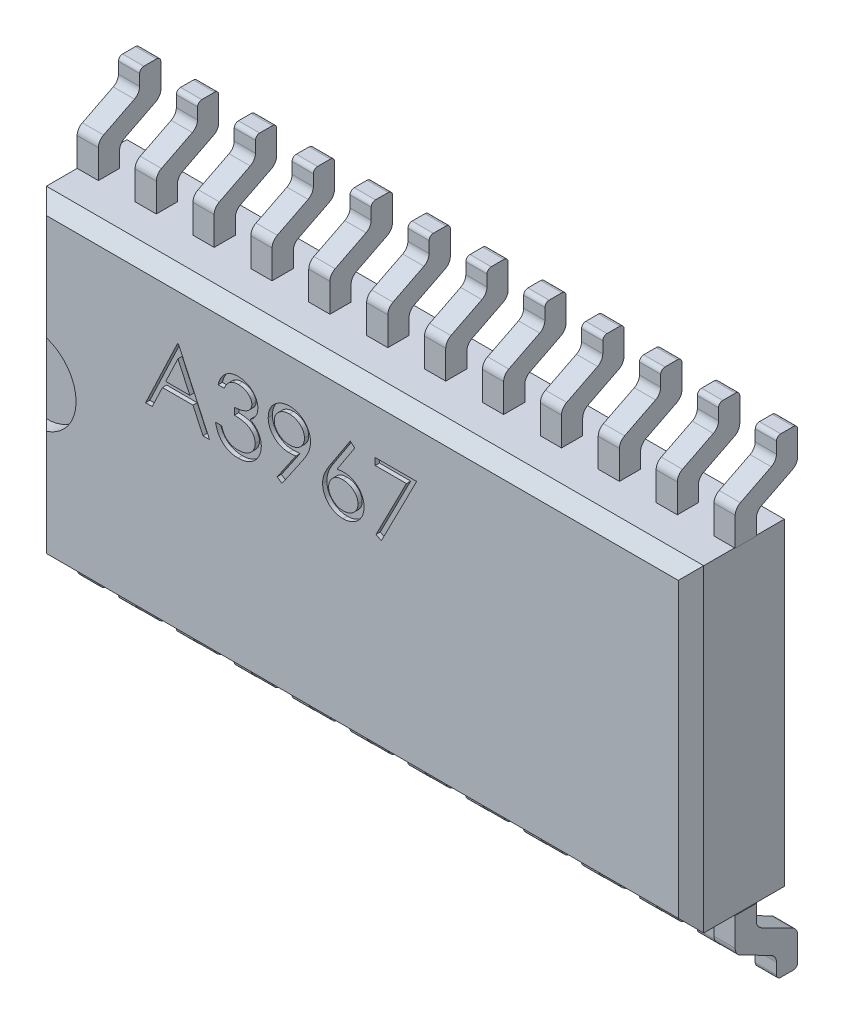
from build123d import *

# Parameters (mm, degrees)
SKETCH1_W           = 15.5
SKETCH1_H           = 7.5
BOSS_EXTRUDE1_DEPTH = 2.5
CHAMFER1_SIZE       = 0.3
BOSS_EXTRUDE2_DEPTH = 0.5
LPATTERN1_COUNT     = 12
LPATTERN1_PITCH     = 1.365
SKETCH3_R           = 1
CUT_EXTRUDE1_DEPTH  = 0.3
CUT_EXTRUDE2_DEPTH  = 0.1
SKETCH5_W           = 0.5
SKETCH5_H           = 0.01
CUT_EXTRUDE3_DEPTH  = 0.01


with BuildPart() as part:
    # Sketch1 → Boss-Extrude1 (new body)
    with BuildSketch(Plane.XY):
        Rectangle(SKETCH1_W, SKETCH1_H)
    extrude(amount=BOSS_EXTRUDE1_DEPTH)

    # Chamfer1
    chamfer1_edges = [part.edges().sort_by_distance(p)[0] for p in [
        (-7.75, 0, 2.5),
        (0, -3.75, 2.5),
        (7.75, 0, 2.5),
        (0, -3.75, 0),
        (-7.75, 0, 0),
        (0, 3.75, 0),
        (7.75, 0, 0),
        (0, 3.75, 2.5),
    ]]
    chamfer(chamfer1_edges, length=CHAMFER1_SIZE)

    # Sketch2 → Boss-Extrude2 (add)
    with BuildSketch(Plane.ZY.offset(7.75)):
        with BuildLine():
            Line((0.97300282, 3.75), (0.97300282, 4.113207126))
            ThreePointArc((0.97300282, 4.113207126), (0.940055615, 4.229754001), (0.85096669, 4.311801887))
            Line((0.85096669, 4.311801887), (0.12203613, 4.680948996))
            ThreePointArc((0.12203613, 4.680948996), (0.032947204, 4.762996882), (0, 4.879543757))
            Line((0, 4.879543757), (0, 5.45))
            ThreePointArc((0, 5.45), (0.029289322, 5.520710678), (0.1, 5.55))
            Line((0.1, 5.55), (0.4, 5.55))
            ThreePointArc((0.4, 5.55), (0.470710678, 5.520710678), (0.5, 5.45))
            Line((0.5, 5.45), (0.5, 5.186792874))
            ThreePointArc((0.5, 5.186792874), (0.532947204, 5.070245999), (0.62203613, 4.988198113))
            Line((0.62203613, 4.988198113), (1.35096669, 4.619051004))
            ThreePointArc((1.35096669, 4.619051004), (1.440055615, 4.537003118), (1.47300282, 4.420456243))
            Line((1.47300282, 4.420456243), (1.47300282, 3.75))
            Line((1.47300282, 3.75), (0.97300282, 3.75))
        make_face()
        with BuildLine():
            Line((0.1, -5.55), (0.4, -5.55))
            ThreePointArc((0.4, -5.55), (0.470710678, -5.520710678), (0.5, -5.45))
            Line((0.5, -5.45), (0.5, -5.186792874))
            ThreePointArc((0.5, -5.186792874), (0.532947204, -5.070245999), (0.62203613, -4.988198113))
            Line((0.62203613, -4.988198113), (1.35096669, -4.619051004))
            ThreePointArc((1.35096669, -4.619051004), (1.440055615, -4.537003118), (1.47300282, -4.420456243))
            Line((1.47300282, -4.420456243), (1.47300282, -3.75))
            Line((1.47300282, -3.75), (0.97300282, -3.75))
            Line((0.97300282, -3.75), (0.97300282, -4.113207126))
            ThreePointArc((0.97300282, -4.113207126), (0.940055615, -4.229754001), (0.85096669, -4.311801887))
            Line((0.85096669, -4.311801887), (0.12203613, -4.680948996))
            ThreePointArc((0.12203613, -4.680948996), (0.032947204, -4.762996882), (0, -4.879543757))
            Line((0, -4.879543757), (0, -5.45))
            ThreePointArc((0, -5.45), (0.029289322, -5.520710678), (0.1, -5.55))
        make_face()
    boss_extrude2 = extrude(amount=-BOSS_EXTRUDE2_DEPTH)

    # LPattern1: Boss-Extrude2 ×12
    with Locations(*[(i * LPATTERN1_PITCH, 0, 0) for i in range(1, LPATTERN1_COUNT)]):
        add(boss_extrude2)

    # Sketch3 → Cut-Extrude1 (cut)
    with BuildSketch(Plane.XY.offset(2.5)):
        with Locations((-7.75, 0)):
            Circle(SKETCH3_R)
    extrude(amount=-CUT_EXTRUDE1_DEPTH, mode=Mode.SUBTRACT)

    # Sketch4 → Cut-Extrude2 (cut)
    # profile 1 of 5: a face of its own
    with BuildSketch(Plane.XY.offset(2.5)):
        Polygon((-4.335376001, 2.385862006), (-3.602683694, 0.798362006), (-3.757553986, 0.798362006), (-3.992244491, 1.307176109), (-4.711898437, 1.307176109), (-4.953267127, 0.798362006), (-5.108773437, 0.798362006), (-4.355728565, 2.385862006), align=None)
        Polygon((-4.347142327, 2.07643943), (-4.634622295, 1.469996621), (-4.067294571, 1.469996621), align=None, mode=Mode.SUBTRACT)
    # profile 2 of 5: a face of its own
    with BuildSketch(Plane.XY.offset(2.5)):
        with BuildLine():
            Line((-3.256690104, 2.019515852), (-3.399158053, 2.019515852))
            add(Edge.make_bspline(
                [(-3.399158053, 2.019515852), (-3.395298363, 2.0354963), (-3.387752987, 2.066736769), (-3.372015159, 2.111371491), (-3.354870497, 2.15360966), (-3.334283296, 2.192660379), (-3.31182754, 2.229308453), (-3.286099734, 2.262722663), (-3.25828686, 2.293752829), (-3.2275234, 2.321290619), (-3.195261472, 2.346226946), (-3.161046483, 2.367488133), (-3.125566814, 2.385778016), (-3.088576643, 2.400845765), (-3.049965844, 2.412196627), (-3.010083479, 2.420432035), (-2.968825034, 2.425780148), (-2.940818091, 2.426302101), (-2.926596955, 2.426567134)],
                knots=[0, 0, 0, 0, 1.162005537, 2.271625781, 3.343758855, 4.383309926, 5.390229558, 6.379919256, 7.361854164, 8.333198761, 9.295911338, 10.242430842, 11.177959212, 12.116337295, 13.062827104, 14.020064771, 14.994644689, 16, 16, 16, 16], degree=3))
            add(Edge.make_bspline(
                [(-2.926596955, 2.426567134), (-2.905876568, 2.425941555), (-2.864887767, 2.424704042), (-2.804670242, 2.413403565), (-2.746600935, 2.395521451), (-2.691315454, 2.370813725), (-2.639962808, 2.34033948), (-2.594271752, 2.30406976), (-2.554861606, 2.262704362), (-2.521798799, 2.217014949), (-2.49591121, 2.168185486), (-2.476822034, 2.1179297), (-2.465200771, 2.066366806), (-2.463694662, 2.031551897), (-2.462940104, 2.014109702)],
                knots=[0, 0, 0, 0, 1.083050992, 2.142477498, 3.193116406, 4.255571735, 5.30263384, 6.308962982, 7.297363603, 8.282367274, 9.249857812, 10.179914175, 11.08814088, 12, 12, 12, 12], degree=3))
            add(Edge.make_bspline(
                [(-2.462940104, 2.014109702), (-2.463467875, 1.997324478), (-2.464500643, 1.964478398), (-2.473269859, 1.916526147), (-2.488027378, 1.871331564), (-2.508469735, 1.828704394), (-2.534931795, 1.788914913), (-2.566986911, 1.751873598), (-2.604861333, 1.717416159), (-2.633562851, 1.697676969), (-2.648339242, 1.68751465)],
                knots=[0, 0, 0, 0, 1.024540389, 2.004866551, 2.965041327, 3.920577974, 4.882998113, 5.874504559, 6.905732034, 8, 8, 8, 8], degree=3))
            add(Edge.make_bspline(
                [(-2.648339242, 1.68751465), (-2.631451982, 1.679360265), (-2.597993436, 1.66320407), (-2.552386588, 1.631519495), (-2.510985552, 1.59493608), (-2.48789708, 1.566387091), (-2.476296474, 1.552042895)],
                knots=[0, 0, 0, 0, 1.015518401, 2.012035669, 3.001164323, 4, 4, 4, 4], degree=3))
            add(Edge.make_bspline(
                [(-2.476296474, 1.552042895), (-2.468657722, 1.541584558), (-2.453505309, 1.520839146), (-2.434802049, 1.487485124), (-2.417834343, 1.453761413), (-2.404612637, 1.418764111), (-2.394373776, 1.382898851), (-2.387054933, 1.34610405), (-2.382508269, 1.308349661), (-2.381857143, 1.282807929), (-2.381529847, 1.269969077)],
                knots=[0, 0, 0, 0, 1.025084078, 2.033381695, 3.024893161, 4.013698104, 4.991890475, 5.976764909, 6.982997093, 8, 8, 8, 8], degree=3))
            add(Edge.make_bspline(
                [(-2.381529847, 1.269969077), (-2.382343787, 1.247739668), (-2.383967837, 1.203385462), (-2.398483971, 1.137855856), (-2.420987119, 1.073800003), (-2.452944372, 1.012533915), (-2.491891421, 0.955211385), (-2.538227065, 0.903923202), (-2.591424828, 0.859836692), (-2.650754533, 0.823002053), (-2.715033374, 0.793557138), (-2.783783732, 0.77312037), (-2.856015006, 0.759809863), (-2.905548316, 0.758382533), (-2.930731069, 0.757656878)],
                knots=[0, 0, 0, 0, 0.955779014, 1.907060117, 2.875433937, 3.871313158, 4.872415639, 5.851225146, 6.836215519, 7.83643374, 8.849228613, 9.86973379, 10.916971861, 12, 12, 12, 12], degree=3))
            add(Edge.make_bspline(
                [(-2.930731069, 0.757656878), (-2.947703395, 0.758050675), (-2.981099272, 0.758825535), (-3.03019543, 0.764122615), (-3.077059201, 0.773797296), (-3.121753947, 0.786816295), (-3.164319374, 0.80332255), (-3.204625593, 0.823877816), (-3.242920581, 0.84805839), (-3.278842962, 0.876149696), (-3.312388455, 0.907573733), (-3.342665584, 0.942888355), (-3.370179133, 0.981440749), (-3.394192401, 1.023678706), (-3.415799162, 1.069056377), (-3.433570524, 1.118154803), (-3.449212193, 1.170535056), (-3.456484514, 1.207037459), (-3.460215745, 1.225765852)],
                knots=[0, 0, 0, 0, 1.048658725, 2.063410685, 3.046034179, 4.001477787, 4.936774919, 5.862367409, 6.792675028, 7.730719943, 8.675894397, 9.627829632, 10.600096036, 11.597688215, 12.626045268, 13.701542398, 14.82072376, 16, 16, 16, 16], degree=3))
            Line((-3.460215745, 1.225765852), (-3.317747796, 1.225765852))
            add(Edge.make_bspline(
                [(-3.317747796, 1.225765852), (-3.314036089, 1.21354255), (-3.306816496, 1.189767165), (-3.294527297, 1.155549598), (-3.28052633, 1.124181481), (-3.265506513, 1.095432707), (-3.249732003, 1.069020153), (-3.232081305, 1.045642234), (-3.213861728, 1.024272125), (-3.200127879, 1.012232247), (-3.19340635, 1.00633977)],
                knots=[0, 0, 0, 0, 1.198163088, 2.33053128, 3.407730985, 4.417276592, 5.372219308, 6.28897303, 7.162600585, 8, 8, 8, 8], degree=3))
            add(Edge.make_bspline(
                [(-3.19340635, 1.00633977), (-3.184517903, 0.999487062), (-3.166768445, 0.985802797), (-3.137844997, 0.968339559), (-3.107426281, 0.953207951), (-3.074853197, 0.941649275), (-3.04082864, 0.931862264), (-3.004802656, 0.9254576), (-2.967093083, 0.921063322), (-2.941344847, 0.92067555), (-2.928186999, 0.920477391)],
                knots=[0, 0, 0, 0, 0.946170439, 1.889420265, 2.845303464, 3.807233317, 4.801018734, 5.828864929, 6.890507805, 8, 8, 8, 8], degree=3))
            add(Edge.make_bspline(
                [(-2.928186999, 0.920477391), (-2.913330946, 0.920756748), (-2.884281217, 0.921303006), (-2.841892763, 0.92632663), (-2.801566885, 0.933642925), (-2.763751308, 0.944942742), (-2.727950685, 0.958904057), (-2.694666865, 0.976433869), (-2.663462917, 0.99700094), (-2.634738508, 1.020377629), (-2.608909653, 1.045968808), (-2.586167802, 1.072735451), (-2.566834473, 1.100564702), (-2.551239065, 1.129610564), (-2.538924351, 1.159752757), (-2.530540899, 1.191075869), (-2.524711819, 1.223323557), (-2.524237106, 1.245244197), (-2.523997796, 1.256294698)],
                knots=[0, 0, 0, 0, 1.217147791, 2.380027433, 3.494444702, 4.572153297, 5.609568379, 6.639424714, 7.649109417, 8.668170816, 9.669597737, 10.625200337, 11.543417969, 12.441394052, 13.322311151, 14.205496177, 15.095365482, 16, 16, 16, 16], degree=3))
            add(Edge.make_bspline(
                [(-2.523997796, 1.256294698), (-2.524691897, 1.27108627), (-2.526076646, 1.300595812), (-2.536648751, 1.344010569), (-2.554038165, 1.385840474), (-2.578382482, 1.42537185), (-2.608016902, 1.462009491), (-2.642653842, 1.494699057), (-2.682580931, 1.521672991), (-2.719329229, 1.540309631), (-2.751879854, 1.553026448), (-2.779736117, 1.561496878), (-2.810922148, 1.5686695), (-2.845060813, 1.575342566), (-2.882409344, 1.581021892), (-2.922927078, 1.585758001), (-2.966622227, 1.589547609), (-2.996871434, 1.591239927), (-3.012459335, 1.592112006)],
                knots=[0, 0, 0, 0, 1.07054697, 2.135767047, 3.216561865, 4.33974944, 5.486079747, 6.621378074, 7.775625952, 8.963672916, 9.598146892, 10.304877434, 11.070270905, 11.915000392, 12.823868403, 13.805723172, 14.86925407, 16, 16, 16, 16], degree=3))
            Line((-3.012459335, 1.592112006), (-3.012459335, 1.754932519))
            add(Edge.make_bspline(
                [(-3.012459335, 1.754932519), (-2.992819163, 1.755265805), (-2.954348892, 1.75591863), (-2.898153975, 1.763814406), (-2.844417865, 1.774736691), (-2.79433145, 1.791466761), (-2.748680069, 1.810897895), (-2.709074393, 1.833509433), (-2.676069294, 1.85864398), (-2.649825165, 1.886689485), (-2.630081551, 1.916768096), (-2.615645825, 1.948117437), (-2.607118534, 1.981012279), (-2.605980221, 2.003461646), (-2.605408053, 2.01474572)],
                knots=[0, 0, 0, 0, 1.321986639, 2.589447074, 3.816329219, 5.01088745, 6.139805852, 7.153945165, 8.075214402, 8.924034688, 9.728124013, 10.488707548, 11.240355623, 12, 12, 12, 12], degree=3))
            add(Edge.make_bspline(
                [(-2.605408053, 2.01474572), (-2.605596018, 2.023035983), (-2.605969965, 2.039529068), (-2.610685873, 2.063625081), (-2.617772492, 2.086984439), (-2.627515083, 2.109507803), (-2.640555352, 2.131038963), (-2.656160924, 2.151761484), (-2.674742884, 2.171557055), (-2.696035998, 2.190008486), (-2.718901352, 2.207593104), (-2.743961071, 2.22252179), (-2.770459564, 2.235287586), (-2.798426169, 2.245814753), (-2.827951641, 2.253733787), (-2.858897259, 2.259419687), (-2.891322029, 2.262974623), (-2.913443493, 2.26348644), (-2.924688902, 2.263746621)],
                knots=[0, 0, 0, 0, 0.884392785, 1.759457502, 2.611959086, 3.489218968, 4.37281399, 5.2945488, 6.255912374, 7.266815255, 8.301784654, 9.332968512, 10.37626691, 11.440494194, 12.520033166, 13.637162961, 14.798855837, 16, 16, 16, 16], degree=3))
            add(Edge.make_bspline(
                [(-2.924688902, 2.263746621), (-2.94276448, 2.263115539), (-2.978070288, 2.261882889), (-3.028967768, 2.251086523), (-3.076284037, 2.233860749), (-3.112451218, 2.213298987), (-3.139158671, 2.193001468), (-3.158243568, 2.175274815), (-3.176985371, 2.155574927), (-3.194151089, 2.132688449), (-3.211511071, 2.108165298), (-3.227315569, 2.080758842), (-3.242673358, 2.051183992), (-3.251927371, 2.030276329), (-3.256690104, 2.019515852)],
                knots=[0, 0, 0, 0, 1.472543308, 2.876219568, 4.221790263, 5.565193594, 6.249813518, 6.953379497, 7.687249741, 8.463570142, 9.283606569, 10.136032583, 11.040678096, 12, 12, 12, 12], degree=3))
        make_face()
    # profile 3 of 5: a face of its own
    with BuildSketch(Plane.XY.offset(2.5)):
        with BuildLine():
            Line((-1.893068309, 0.757656878), (-2.006915464, 0.836841073))
            Line((-2.006915464, 0.836841073), (-1.56551923, 1.482080956))
            add(Edge.make_bspline(
                [(-1.56551923, 1.482080956), (-1.593681814, 1.47863696), (-1.649135511, 1.471855538), (-1.704986983, 1.470609734), (-1.732473858, 1.469996621)],
                knots=[0, 0, 0, 0, 1.015715272, 2, 2, 2, 2], degree=3))
            add(Edge.make_bspline(
                [(-1.732473858, 1.469996621), (-1.749139001, 1.470423467), (-1.78185122, 1.471261327), (-1.829944148, 1.477902433), (-1.876156527, 1.488130527), (-1.920365842, 1.50339264), (-1.96273826, 1.522360185), (-2.00318128, 1.545881045), (-2.041640459, 1.573551756), (-2.077702749, 1.605226006), (-2.110501287, 1.640004979), (-2.139721855, 1.67681486), (-2.164006582, 1.716083247), (-2.184179891, 1.757009097), (-2.199479061, 1.800180638), (-2.210619926, 1.845106616), (-2.217478994, 1.892101896), (-2.218295012, 1.924090081), (-2.218709335, 1.940331657)],
                knots=[0, 0, 0, 0, 1.060718605, 2.082097864, 3.085795603, 4.069760067, 5.054557537, 6.03741023, 7.043284206, 8.066802108, 9.088538119, 10.083643548, 11.053783639, 12.022749082, 12.983451788, 13.964007469, 14.966251758, 16, 16, 16, 16], degree=3))
            add(Edge.make_bspline(
                [(-2.218709335, 1.940331657), (-2.217922645, 1.962542439), (-2.216378532, 2.006137698), (-2.203951347, 2.069834443), (-2.183513264, 2.130062626), (-2.155016108, 2.186663892), (-2.119122859, 2.238824035), (-2.07598432, 2.28581794), (-2.025862879, 2.326977213), (-1.96990032, 2.362357633), (-1.9094152, 2.390812436), (-1.846065488, 2.411785261), (-1.780336583, 2.424121836), (-1.735810533, 2.42574828), (-1.713393329, 2.426567134)],
                knots=[0, 0, 0, 0, 1.022988612, 2.007919123, 2.978103895, 3.94594894, 4.918897164, 5.887013414, 6.875921846, 7.89917871, 8.930658928, 9.948724884, 10.967259574, 12, 12, 12, 12], degree=3))
            add(Edge.make_bspline(
                [(-1.713393329, 2.426567134), (-1.691400367, 2.425737025), (-1.647944348, 2.424096806), (-1.58404112, 2.412084434), (-1.52283573, 2.391838515), (-1.464667468, 2.363860159), (-1.410810663, 2.328789605), (-1.362380206, 2.287000017), (-1.320481301, 2.238465367), (-1.285182612, 2.184359516), (-1.256847987, 2.126226636), (-1.236404487, 2.065546071), (-1.223819858, 2.002754222), (-1.222234024, 1.960211729), (-1.221433694, 1.938741613)],
                knots=[0, 0, 0, 0, 1.026385292, 2.028040595, 3.023318987, 4.028184125, 5.03290303, 6.015178782, 7.004435299, 8.016004309, 9.023023918, 10.015172535, 10.998308025, 12, 12, 12, 12], degree=3))
            add(Edge.make_bspline(
                [(-1.221433694, 1.938741613), (-1.221968186, 1.92207569), (-1.223052271, 1.888273034), (-1.230643381, 1.836914986), (-1.243533965, 1.784549607), (-1.258162415, 1.740225883), (-1.272283076, 1.703618836), (-1.285573232, 1.674702941), (-1.300319816, 1.644267725), (-1.317518685, 1.612632326), (-1.336007298, 1.579393462), (-1.35689847, 1.544884515), (-1.37971564, 1.509059179), (-1.395966977, 1.484907822), (-1.404288762, 1.472540692)],
                knots=[0, 0, 0, 0, 1.179839688, 2.393009684, 3.667231171, 4.993948276, 5.694988576, 6.444077775, 7.246288328, 8.089075292, 8.993003841, 9.939041771, 10.944649915, 12, 12, 12, 12], degree=3))
            Line((-1.404288762, 1.472540692), (-1.893068309, 0.757656878))
        make_face()
        with BuildLine():
            add(Edge.make_bspline(
                [(-1.706079126, 1.632817134), (-1.693454413, 1.633162023), (-1.668878387, 1.633833403), (-1.632875112, 1.637919738), (-1.598891634, 1.645165081), (-1.566837175, 1.655560808), (-1.53639033, 1.668105083), (-1.50803471, 1.684076234), (-1.481746583, 1.703133779), (-1.457349916, 1.724546893), (-1.43568553, 1.748336979), (-1.416389227, 1.773236738), (-1.399987827, 1.799355472), (-1.387032341, 1.827020273), (-1.376380408, 1.855557721), (-1.369024381, 1.885427375), (-1.364949344, 1.916473614), (-1.364254666, 1.937564077), (-1.363901642, 1.948281878)],
                knots=[0, 0, 0, 0, 1.163407946, 2.26475976, 3.333800367, 4.359385343, 5.366239384, 6.363380779, 7.350133999, 8.353570782, 9.349036268, 10.310270964, 11.253520213, 12.184142, 13.120487599, 14.056272588, 15.012232024, 16, 16, 16, 16], degree=3))
            add(Edge.make_bspline(
                [(-1.363901642, 1.948281878), (-1.364205385, 1.959004155), (-1.364803948, 1.980133716), (-1.369606044, 2.011225919), (-1.378053913, 2.041022506), (-1.389388883, 2.069686601), (-1.404320562, 2.096982698), (-1.422238215, 2.123253497), (-1.443525433, 2.148332426), (-1.468019454, 2.171629662), (-1.494432984, 2.193105316), (-1.522581853, 2.212058286), (-1.552234047, 2.2279429), (-1.583208662, 2.241050647), (-1.615570235, 2.251279488), (-1.649299615, 2.258635222), (-1.684567246, 2.262704553), (-1.708507329, 2.263394841), (-1.720707532, 2.263746621)],
                knots=[0, 0, 0, 0, 0.972161553, 1.915763587, 2.844109794, 3.775983486, 4.705125789, 5.659731448, 6.655561913, 7.682237399, 8.721216875, 9.739758359, 10.754845918, 11.767244016, 12.7857855, 13.828538656, 14.893392813, 16, 16, 16, 16], degree=3))
            add(Edge.make_bspline(
                [(-1.720707532, 2.263746621), (-1.73280163, 2.263394273), (-1.756530151, 2.262702968), (-1.791484252, 2.258642957), (-1.824985567, 2.251230019), (-1.857253373, 2.241055385), (-1.888227068, 2.227941922), (-1.917877864, 2.212057454), (-1.946033318, 2.193109679), (-1.972421523, 2.171612764), (-1.996958795, 2.148440867), (-2.017880017, 2.123143634), (-2.035838675, 2.096996364), (-2.050749837, 2.069682969), (-2.062090265, 2.041023475), (-2.070536673, 2.011225657), (-2.075339162, 1.980133784), (-2.07593767, 1.959004178), (-2.076241386, 1.948281878)],
                knots=[0, 0, 0, 0, 1.099389452, 2.15699305, 3.192601482, 4.213358962, 5.227959689, 6.245255729, 7.266013209, 8.307253147, 9.336162325, 10.327954924, 11.284637477, 12.215801273, 13.149702402, 14.080068371, 15.025723358, 16, 16, 16, 16], degree=3))
            add(Edge.make_bspline(
                [(-2.076241386, 1.948281878), (-2.075966555, 1.937555731), (-2.075424539, 1.916401805), (-2.070195862, 1.885320191), (-2.061451786, 1.855525903), (-2.049740848, 1.826729239), (-2.034318698, 1.799210218), (-2.015393953, 1.773099308), (-1.993211794, 1.748100514), (-1.968068748, 1.724602243), (-1.940551404, 1.703033935), (-1.911161451, 1.68419694), (-1.880404846, 1.668289081), (-1.848173321, 1.655524954), (-1.814705737, 1.645268949), (-1.779701302, 1.637933091), (-1.74327578, 1.633872599), (-1.718596967, 1.633172331), (-1.706079126, 1.632817134)],
                knots=[0, 0, 0, 0, 0.952633368, 1.87876736, 2.791047057, 3.707742249, 4.635551637, 5.587206343, 6.568248508, 7.601284464, 8.641511608, 9.671105535, 10.699146789, 11.713763218, 12.747829548, 13.806491675, 14.887386225, 16, 16, 16, 16], degree=3))
        make_face(mode=Mode.SUBTRACT)
    # profile 4 of 5: a face of its own
    with BuildSketch(Plane.XY.offset(2.5)):
        with BuildLine():
            Line((-0.285215745, 2.426567134), (-0.175502704, 2.340386746))
            Line((-0.175502704, 2.340386746), (-0.59495633, 1.698962968))
            add(Edge.make_bspline(
                [(-0.59495633, 1.698962968), (-0.567029811, 1.703414254), (-0.512555979, 1.712096993), (-0.457417161, 1.713529346), (-0.430545773, 1.714227391)],
                knots=[0, 0, 0, 0, 1.025318673, 2, 2, 2, 2], degree=3))
            add(Edge.make_bspline(
                [(-0.430545773, 1.714227391), (-0.414411105, 1.713793726), (-0.382650491, 1.712940069), (-0.336020263, 1.706370608), (-0.291212424, 1.69601779), (-0.248412693, 1.680926445), (-0.207467448, 1.661648591), (-0.168141718, 1.638544175), (-0.131174735, 1.61042017), (-0.09609045, 1.579003565), (-0.064237445, 1.544206933), (-0.036036163, 1.507285612), (-0.012347582, 1.46827807), (0.006872018, 1.427204063), (0.021796731, 1.384126906), (0.032676841, 1.339101714), (0.039108299, 1.29209744), (0.039981647, 1.260130553), (0.040425281, 1.243892355)],
                knots=[0, 0, 0, 0, 1.04369286, 2.054478336, 3.041073146, 4.015093852, 4.984733326, 5.965804835, 6.960378782, 7.985147595, 9.009457201, 10.008161701, 10.986880575, 11.956520048, 12.937015923, 13.931873656, 14.949455224, 16, 16, 16, 16], degree=3))
            add(Edge.make_bspline(
                [(0.040425281, 1.243892355), (0.039779801, 1.22167656), (0.03850965, 1.177961135), (0.025853285, 1.114290271), (0.006186589, 1.053633023), (-0.021924647, 0.996957835), (-0.056841656, 0.944342384), (-0.09942185, 0.897721833), (-0.148155147, 0.856142923), (-0.203258087, 0.821373671), (-0.26255936, 0.792978716), (-0.324858302, 0.772583767), (-0.389549901, 0.760027336), (-0.433457705, 0.75845317), (-0.455668469, 0.757656878)],
                knots=[0, 0, 0, 0, 1.031375318, 2.029502543, 3.004789286, 3.987476834, 4.960371455, 5.9300674, 6.912260825, 7.929083631, 8.949397511, 9.960523116, 10.96833055, 12, 12, 12, 12], degree=3))
            add(Edge.make_bspline(
                [(-0.455668469, 0.757656878), (-0.477030187, 0.758350028), (-0.51934401, 0.759723038), (-0.581588884, 0.771954017), (-0.641398181, 0.79177831), (-0.698352865, 0.819089786), (-0.751112572, 0.853587469), (-0.798313771, 0.895117503), (-0.839721112, 0.942792153), (-0.874181029, 0.996604025), (-0.901512668, 1.054429827), (-0.922009527, 1.114726323), (-0.933982109, 1.177273815), (-0.935655133, 1.219674188), (-0.936497796, 1.241030275)],
                knots=[0, 0, 0, 0, 1.012016664, 2.004627821, 2.994792927, 3.992885782, 4.990978636, 5.973936114, 6.964471063, 7.975201453, 8.993600317, 9.990122807, 10.98767138, 12, 12, 12, 12], degree=3))
            add(Edge.make_bspline(
                [(-0.936497796, 1.241030275), (-0.935961926, 1.257379068), (-0.934867783, 1.29076018), (-0.927228102, 1.341317079), (-0.914952285, 1.393047391), (-0.901204423, 1.436932328), (-0.886678521, 1.47288309), (-0.874589691, 1.501867888), (-0.859542914, 1.531695232), (-0.843498559, 1.563387917), (-0.825012408, 1.596129166), (-0.804912095, 1.630466188), (-0.782641896, 1.665852891), (-0.767029894, 1.689866865), (-0.759048878, 1.702143056)],
                knots=[0, 0, 0, 0, 1.173818275, 2.396712641, 3.66331629, 4.989737886, 5.693666774, 6.447286557, 7.243889047, 8.091586357, 8.998013824, 9.943181721, 10.948533338, 12, 12, 12, 12], degree=3))
            Line((-0.759048878, 1.702143056), (-0.285215745, 2.426567134))
        make_face()
        with BuildLine():
            add(Edge.make_bspline(
                [(-0.460438601, 1.551406878), (-0.472531834, 1.551053979), (-0.49615343, 1.550364666), (-0.53080965, 1.546361784), (-0.563608875, 1.538823851), (-0.594985646, 1.529223408), (-0.624353354, 1.516023091), (-0.651925435, 1.499988525), (-0.677808512, 1.481110348), (-0.701731481, 1.459656006), (-0.723421114, 1.436166434), (-0.742099698, 1.411007044), (-0.758211644, 1.384784173), (-0.771311611, 1.357278721), (-0.781512467, 1.328501201), (-0.788891281, 1.29858397), (-0.792997804, 1.26732641), (-0.793680988, 1.246129882), (-0.794029847, 1.235306117)],
                knots=[0, 0, 0, 0, 1.129588631, 2.206414736, 3.251139165, 4.268635594, 5.265702196, 6.250456724, 7.242448911, 8.251968645, 9.246821453, 10.222880186, 11.173611482, 12.116736599, 13.062300278, 14.020270554, 14.989073742, 16, 16, 16, 16], degree=3))
            add(Edge.make_bspline(
                [(-0.794029847, 1.235306117), (-0.793745748, 1.224579161), (-0.793188671, 1.203545199), (-0.788130297, 1.1725485), (-0.78040367, 1.142719417), (-0.768909991, 1.114211727), (-0.755199938, 1.086590897), (-0.737100023, 1.060857393), (-0.717044552, 1.035448289), (-0.693071518, 1.012315479), (-0.667343421, 0.99079051), (-0.639856447, 0.971976253), (-0.611208894, 0.955880738), (-0.581013999, 0.943266419), (-0.549700161, 0.932913974), (-0.517006481, 0.925628946), (-0.482910221, 0.921510279), (-0.459813485, 0.920826206), (-0.448036258, 0.920477391)],
                knots=[0, 0, 0, 0, 0.989467248, 1.94019797, 2.891935182, 3.827694429, 4.772920941, 5.730924762, 6.725747692, 7.756678648, 8.79901574, 9.819492441, 10.826891316, 11.826466727, 12.835195252, 13.867842842, 14.912794438, 16, 16, 16, 16], degree=3))
            add(Edge.make_bspline(
                [(-0.448036258, 0.920477391), (-0.436259049, 0.920826233), (-0.413162351, 0.92151036), (-0.379065817, 0.925628639), (-0.346373151, 0.932915104), (-0.315055628, 0.943262325), (-0.284874336, 0.955895926), (-0.256251837, 0.971876118), (-0.229024809, 0.990906215), (-0.203279823, 1.012278695), (-0.179406572, 1.035579952), (-0.158870092, 1.060630577), (-0.141324483, 1.086798879), (-0.127066834, 1.114102922), (-0.115699748, 1.142736654), (-0.10793394, 1.172543882), (-0.102886012, 1.203546408), (-0.1023275, 1.22457957), (-0.102042668, 1.235306117)],
                knots=[0, 0, 0, 0, 1.087397944, 2.132534446, 3.165364764, 4.174271784, 5.174024072, 6.181601208, 7.194203697, 8.236725232, 9.267838612, 10.269026844, 11.221737037, 12.171628256, 13.107553087, 14.05945871, 15.010357665, 16, 16, 16, 16], degree=3))
            add(Edge.make_bspline(
                [(-0.102042668, 1.235306117), (-0.102292265, 1.246144002), (-0.102782143, 1.267415247), (-0.108322948, 1.298569988), (-0.116007525, 1.328653207), (-0.127611257, 1.357475833), (-0.142686404, 1.384924129), (-0.161048521, 1.411136748), (-0.182290437, 1.436314656), (-0.206827535, 1.459702072), (-0.233538462, 1.48108664), (-0.261939103, 1.499964081), (-0.291651648, 1.515895767), (-0.322645972, 1.529188631), (-0.355277208, 1.538781429), (-0.389018541, 1.546334864), (-0.424301518, 1.550354422), (-0.44823948, 1.551051591), (-0.460438601, 1.551406878)],
                knots=[0, 0, 0, 0, 0.978206639, 1.919901502, 2.851605144, 3.780102724, 4.718870031, 5.675451981, 6.667674623, 7.690630536, 8.733308323, 9.756129687, 10.767539656, 11.776269907, 12.797430371, 13.836405707, 14.897401972, 16, 16, 16, 16], degree=3))
        make_face(mode=Mode.SUBTRACT)
    # profile 5 of 5: a face of its own
    with BuildSketch(Plane.XY.offset(2.5)):
        Polygon((0.305008614, 2.385862006), (1.281931691, 2.385862006), (0.447476563, 0.757656878), (0.324407152, 0.825392755), (1.04088101, 2.223041493), (0.305008614, 2.223041493), align=None)
    extrude(amount=-CUT_EXTRUDE2_DEPTH, mode=Mode.SUBTRACT)

    # Sketch5 → Cut-Extrude3 (cut)
    with BuildSketch(Plane.ZY.offset(7.75)):
        with Locations((1.22300282, 3.755)):
            Rectangle(SKETCH5_W, SKETCH5_H)
        with Locations((1.22300282, -3.755)):
            Rectangle(SKETCH5_W, SKETCH5_H)
    extrude(amount=-CUT_EXTRUDE3_DEPTH, mode=Mode.SUBTRACT)


solid = part.part
